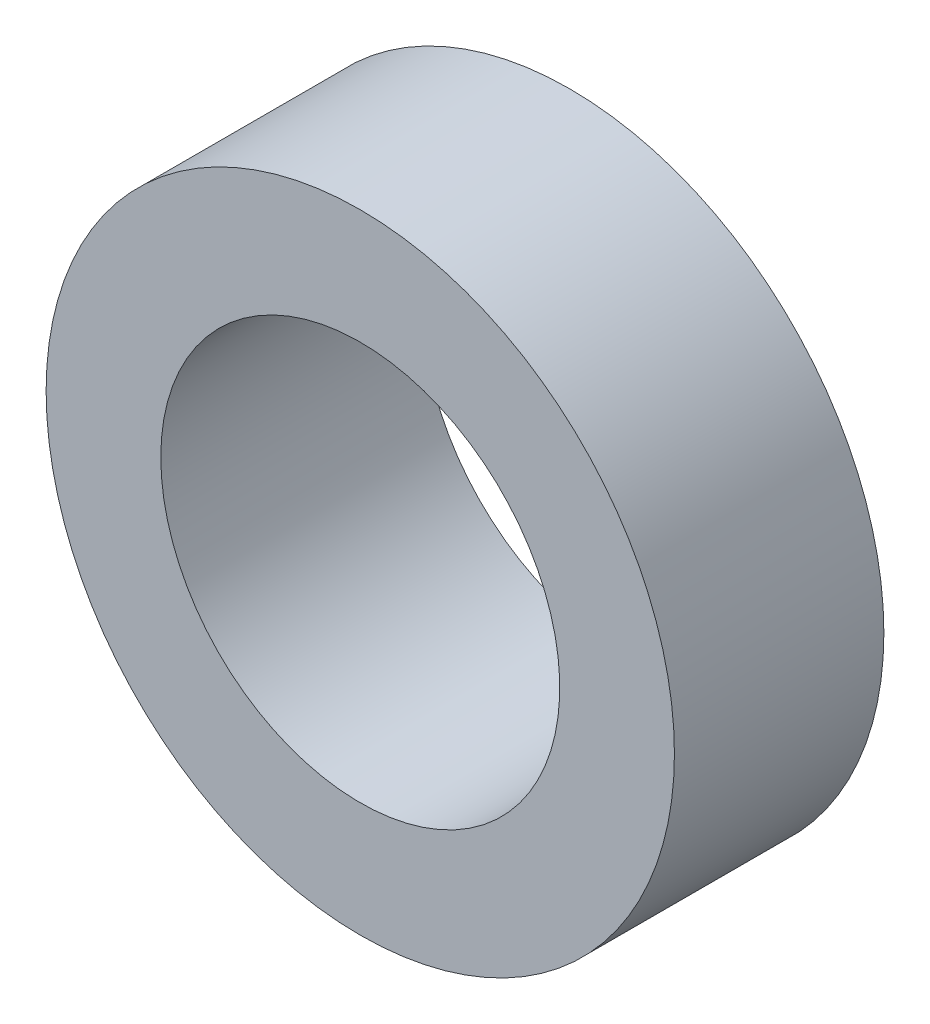
from build123d import *

# Parameters (mm, degrees)
CROQUIS1_R              = 23.05
SALIENTE_EXTRUIR1_DEPTH = 25
CROQUIS2_R              = 19.05
CORTAR_EXTRUIR1_DEPTH   = 29
CROQUIS3_R              = 23.05
CROQUIS3_R_2            = 20.5
CORTAR_EXTRUIR2_DEPTH   = 5
CROQUIS4_R              = 30
SALIENTE_EXTRUIR3_DEPTH = 20
CROQUIS5_R              = 19.05
CORTAR_EXTRUIR3_DEPTH   = 20


with BuildPart() as part:
    # Croquis1 → Saliente-Extruir1 (new body)
    with BuildSketch(Plane.XY):
        Circle(CROQUIS1_R)
    extrude(amount=SALIENTE_EXTRUIR1_DEPTH)

    # Croquis2 → Cortar-Extruir1 (cut)
    with BuildSketch(Plane(origin=(0, 0, 0), x_dir=(-1, 0, 0), z_dir=(0, 0, -1))):
        Circle(CROQUIS2_R)
    extrude(amount=-CORTAR_EXTRUIR1_DEPTH, mode=Mode.SUBTRACT)

    # Croquis3 → Cortar-Extruir2 (cut)
    with BuildSketch(Plane(origin=(0, 0, 0), x_dir=(-1, 0, 0), z_dir=(0, 0, -1))):
        Circle(CROQUIS3_R)
        Circle(CROQUIS3_R_2, mode=Mode.SUBTRACT)
    extrude(amount=-CORTAR_EXTRUIR2_DEPTH, mode=Mode.SUBTRACT)

    # Croquis4 → Saliente-Extruir3 (add)
    with BuildSketch(Plane.XY.offset(25)):
        Circle(CROQUIS4_R)
    extrude(amount=-SALIENTE_EXTRUIR3_DEPTH)

    # Croquis5 → Cortar-Extruir3 (cut)
    with BuildSketch(Plane(origin=(0, 0, 5), x_dir=(-1, 0, 0), z_dir=(0, 0, -1))):
        Circle(CROQUIS5_R)
    extrude(amount=-CORTAR_EXTRUIR3_DEPTH, mode=Mode.SUBTRACT)


solid = part.part
